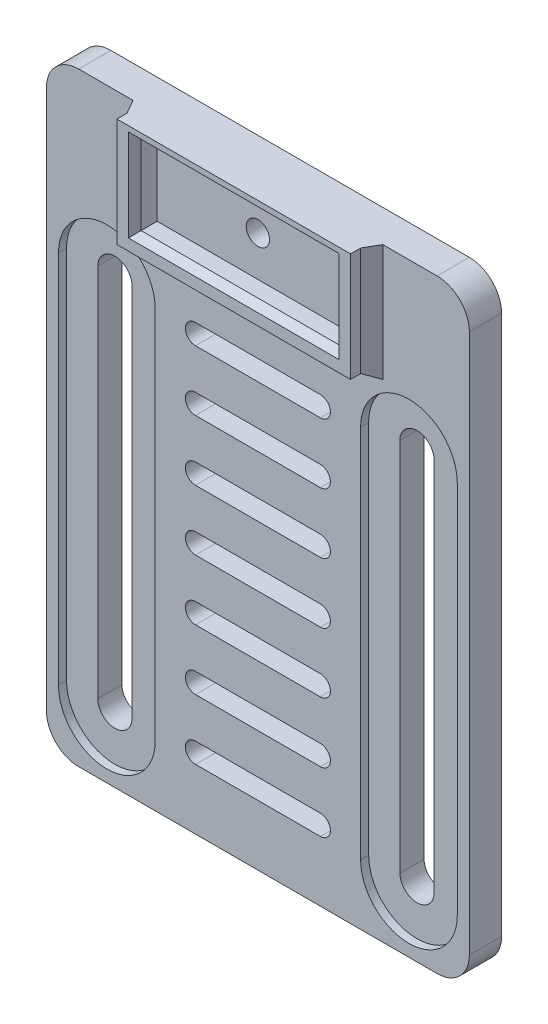
from build123d import *
from OCP.BRepFilletAPI import BRepFilletAPI_MakeChamfer

# Parameters (mm, degrees)
CROQUIS1_W              = 105
CROQUIS1_H              = 150
SALIENTE_EXTRUIR1_DEPTH = 8
CROQUIS2_R              = 2.9
CORTAR_EXTRUIR4_DEPTH   = 8
CROQUIS3_W              = 58
CROQUIS3_H              = 27
SALIENTE_EXTRUIR2_DEPTH = 6
REDONDEO1_R             = 8
REDONDEO2_R             = 8
REDONDEO3_R             = 8
REDONDEO4_R             = 8
CORTAR_EXTRUIR5_DEPTH   = 2
CHAFL_N1_SIZE           = 2
CHAFL_N1_SIZE2          = 1.154700538
CHAFL_N2_SIZE           = 2
CHAFL_N2_SIZE2          = 3.464101615
CORTAR_EXTRUIR6_DEPTH   = 8


with BuildPart() as part:
    # Croquis1 → Saliente-Extruir1 (new body)
    with BuildSketch(Plane.XY):
        with Locations((52.5, 75)):
            Rectangle(CROQUIS1_W, CROQUIS1_H)
    extrude(amount=SALIENTE_EXTRUIR1_DEPTH)

    # Croquis2 → Cortar-Extruir4 (cut)
    with BuildSketch(Plane.XY.offset(8)):
        with Locations((52.5, 137)):
            Circle(CROQUIS2_R)
        with BuildLine():
            Line((19.25, 108), (19.25, 15))
            ThreePointArc((19.25, 15), (15, 10.75), (10.75, 15))
            Line((10.75, 15), (10.75, 108))
            ThreePointArc((10.75, 108), (15, 112.25), (19.25, 108))
        make_face()
        with BuildLine():
            Line((85.75, 108), (85.75, 15))
            ThreePointArc((85.75, 15), (90, 10.75), (94.25, 15))
            Line((94.25, 15), (94.25, 108))
            ThreePointArc((94.25, 108), (90, 112.25), (85.75, 108))
        make_face()
    extrude(amount=-CORTAR_EXTRUIR4_DEPTH, mode=Mode.SUBTRACT)

    # Croquis3 → Saliente-Extruir2 (add)
    with BuildSketch(Plane.XY.offset(8)):
        with Locations((52.5, 136.5)):
            Rectangle(CROQUIS3_W, CROQUIS3_H)
        Polygon((77.5, 127), (52.5, 127), (27.5, 127), (27.5, 147.5), (77.5, 147.5), align=None, mode=Mode.SUBTRACT)
    extrude(amount=SALIENTE_EXTRUIR2_DEPTH)

    # Redondeo1
    redondeo1_edges = [part.edges().sort_by_distance(p)[0] for p in [
        (0, 150, 4),
    ]]
    fillet(redondeo1_edges, radius=REDONDEO1_R)

    # Redondeo2
    redondeo2_edges = [part.edges().sort_by_distance(p)[0] for p in [
        (105, 150, 4),
    ]]
    fillet(redondeo2_edges, radius=REDONDEO2_R)

    # Redondeo3
    redondeo3_edges = [part.edges().sort_by_distance(p)[0] for p in [
        (0, 0, 4),
    ]]
    fillet(redondeo3_edges, radius=REDONDEO3_R)

    # Redondeo4
    redondeo4_edges = [part.edges().sort_by_distance(p)[0] for p in [
        (105, 0, 4),
    ]]
    fillet(redondeo4_edges, radius=REDONDEO4_R)

    # Croquis4 → Cortar-Extruir5 (cut)
    # profile 1 of 2: a face of its own
    with BuildSketch(Plane.XY.offset(8)):
        with BuildLine():
            Line((27, 108), (27, 15))
            ThreePointArc((27, 15), (15, 3), (3, 15))
            Line((3, 15), (3, 108))
            ThreePointArc((3, 108), (15, 120), (27, 108))
        make_face()
        with BuildLine():
            Line((10.75, 108), (10.75, 15))
            ThreePointArc((10.75, 15), (15, 10.75), (19.25, 15))
            Line((19.25, 15), (19.25, 108))
            ThreePointArc((19.25, 108), (15, 112.25), (10.75, 108))
        make_face(mode=Mode.SUBTRACT)
    # profile 2 of 2: a face of its own
    with BuildSketch(Plane.XY.offset(8)):
        with BuildLine():
            Line((78, 108), (78, 15))
            ThreePointArc((78, 15), (90, 3), (102, 15))
            Line((102, 15), (102, 108))
            ThreePointArc((102, 108), (90, 120), (78, 108))
        make_face()
        with BuildLine():
            Line((85.75, 108), (85.75, 15))
            ThreePointArc((85.75, 15), (90, 10.75), (94.25, 15))
            Line((94.25, 15), (94.25, 108))
            ThreePointArc((94.25, 108), (90, 112.25), (85.75, 108))
        make_face(mode=Mode.SUBTRACT)
    extrude(amount=-CORTAR_EXTRUIR5_DEPTH, mode=Mode.SUBTRACT)

    # Chaflán1: one chamfer whose edges measure the first distance from different faces: ONE call of the kernel's chamfer builder (chamfer() names one face for all edges)
    chafl_n1_edges_1 = [part.edges().sort_by_distance(p)[0] for p in [
        (52.5, 127, 14),
    ]]
    chafl_n1_side_1 = [part.faces().sort_by_distance(p)[0] for p in [
        (52.5, 127, 11),
    ]]
    chafl_n1_edges_2 = [part.edges().sort_by_distance(p)[0] for p in [
        (27.5, 137.25, 14),
    ]]
    chafl_n1_side_2 = [part.faces().sort_by_distance(p)[0] for p in [
        (27.5, 137.25, 11),
    ]]
    chafl_n1_edges_3 = [part.edges().sort_by_distance(p)[0] for p in [
        (52.5, 147.5, 14),
    ]]
    chafl_n1_side_3 = [part.faces().sort_by_distance(p)[0] for p in [
        (52.5, 147.5, 11),
    ]]
    chafl_n1_edges_4 = [part.edges().sort_by_distance(p)[0] for p in [
        (77.5, 137.25, 14),
    ]]
    chafl_n1_side_4 = [part.faces().sort_by_distance(p)[0] for p in [
        (77.5, 137.25, 11),
    ]]
    chafl_n1 = BRepFilletAPI_MakeChamfer(part.part.solid().wrapped)
    for e in chafl_n1_edges_1:
        chafl_n1.Add(CHAFL_N1_SIZE, CHAFL_N1_SIZE2, e.wrapped, chafl_n1_side_1[0].wrapped)  # the first distance lies on this face
    for e in chafl_n1_edges_2:
        chafl_n1.Add(CHAFL_N1_SIZE, CHAFL_N1_SIZE2, e.wrapped, chafl_n1_side_2[0].wrapped)  # the first distance lies on this face
    for e in chafl_n1_edges_3:
        chafl_n1.Add(CHAFL_N1_SIZE, CHAFL_N1_SIZE2, e.wrapped, chafl_n1_side_3[0].wrapped)  # the first distance lies on this face
    for e in chafl_n1_edges_4:
        chafl_n1.Add(CHAFL_N1_SIZE, CHAFL_N1_SIZE2, e.wrapped, chafl_n1_side_4[0].wrapped)  # the first distance lies on this face
    add(Compound.cast(chafl_n1.Shape()), mode=Mode.REPLACE)

    # Chaflán2
    chafl_n2_edges = [part.edges().sort_by_distance(p)[0] for p in [
        (52.5, 123, 8),
        (81.5, 136.5, 8),
        (23.5, 136.5, 8),
    ]]
    chafl_n2_side = [part.faces().sort_by_distance(p)[0] for p in [
        (52.5, 72.279712642, 8),
    ]]
    chamfer(chafl_n2_edges, length=CHAFL_N2_SIZE, length2=CHAFL_N2_SIZE2, reference=chafl_n2_side[0])

    # Croquis6 → Cortar-Extruir6 (cut)
    with BuildSketch(Plane.XY.offset(8)):
        with BuildLine():
            Line((37, 20), (68, 20))
            ThreePointArc((68, 20), (70.5, 17.5), (68, 15))
            Line((68, 15), (37, 15))
            ThreePointArc((37, 15), (34.5, 17.5), (37, 20))
        make_face()
        with BuildLine():
            Line((37, 30), (68, 30))
            ThreePointArc((68, 30), (70.5, 32.5), (68, 35))
            Line((68, 35), (37, 35))
            ThreePointArc((37, 35), (34.5, 32.5), (37, 30))
        make_face()
        with BuildLine():
            Line((37, 45), (68, 45))
            ThreePointArc((68, 45), (70.5, 47.5), (68, 50))
            Line((68, 50), (37, 50))
            ThreePointArc((37, 50), (34.5, 47.5), (37, 45))
        make_face()
        with BuildLine():
            Line((37, 60), (68, 60))
            ThreePointArc((68, 60), (70.5, 62.5), (68, 65))
            Line((68, 65), (37, 65))
            ThreePointArc((37, 65), (34.5, 62.5), (37, 60))
        make_face()
        with BuildLine():
            Line((37, 75), (68, 75))
            ThreePointArc((68, 75), (70.5, 77.5), (68, 80))
            Line((68, 80), (37, 80))
            ThreePointArc((37, 80), (34.5, 77.5), (37, 75))
        make_face()
        with BuildLine():
            Line((37, 90), (68, 90))
            ThreePointArc((68, 90), (70.5, 92.5), (68, 95))
            Line((68, 95), (37, 95))
            ThreePointArc((37, 95), (34.5, 92.5), (37, 90))
        make_face()
        with BuildLine():
            Line((37, 105), (68, 105))
            ThreePointArc((68, 105), (70.5, 107.5), (68, 110))
            Line((68, 110), (37, 110))
            ThreePointArc((37, 110), (34.5, 107.5), (37, 105))
        make_face()
    extrude(amount=-CORTAR_EXTRUIR6_DEPTH, mode=Mode.SUBTRACT)


solid = part.part
